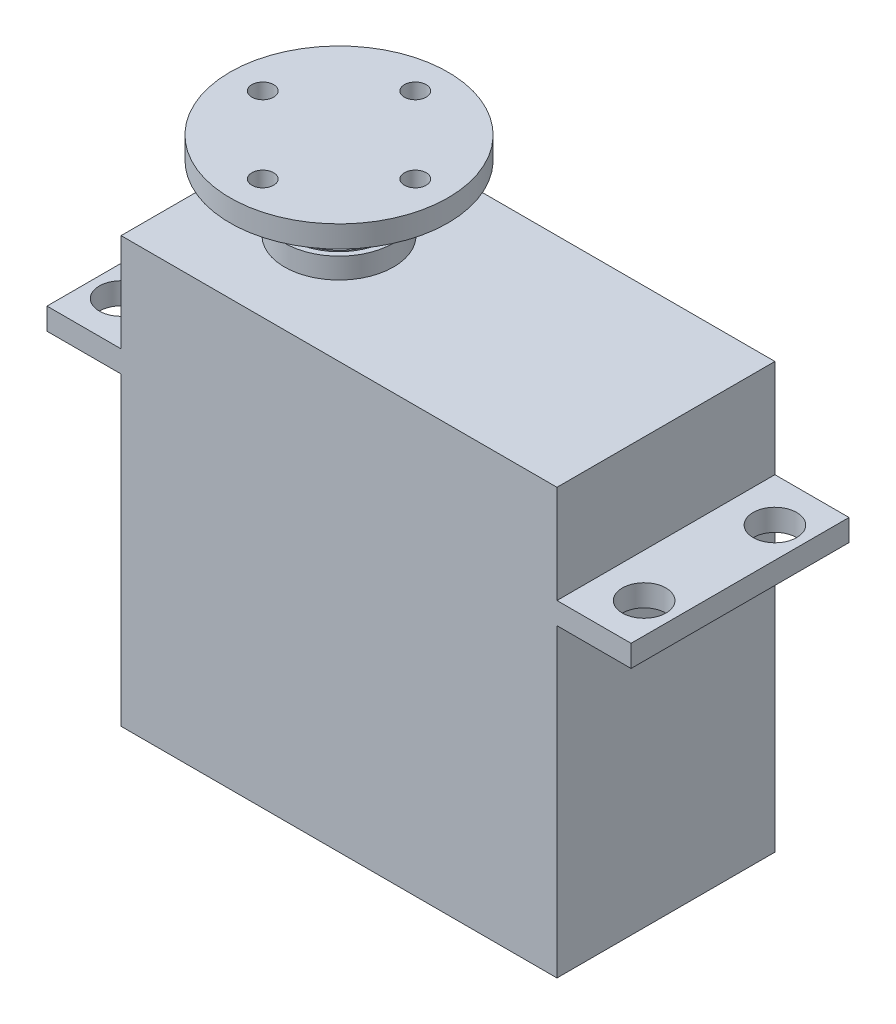
from build123d import *

# Parameters (mm, degrees)
SKETCH1_W           = 6.8
SKETCH1_H           = 2
SKETCH1_W_2         = 40
SKETCH1_H_2         = 39
BOSS_EXTRUDE1_DEPTH = 20
SKETCH2_R           = 4.5
BOSS_EXTRUDE2_DEPTH = 2
SKETCH3_R           = 5
BOSS_EXTRUDE3_DEPTH = 1.9
SKETCH4_R           = 3
BOSS_EXTRUDE4_DEPTH = 4
SKETCH5_R           = 10
BOSS_EXTRUDE5_DEPTH = 2
SKETCH6_R           = 2
CUT_EXTRUDE1_DEPTH  = 10
SKETCH7_R           = 2
CUT_EXTRUDE2_DEPTH  = 10
CUT_EXTRUDE3_DEPTH  = 5


with BuildPart() as part:
    # Sketch1 → Boss-Extrude1 (new body)
    with BuildSketch(Plane.XY):
        with Locations((-23.4, 7.722986842)):
            Rectangle(SKETCH1_W, SKETCH1_H)
        with Locations((0, -1.777013158)):
            Rectangle(SKETCH1_W_2, SKETCH1_H_2)
        with Locations((23.4, 7.722986842)):
            Rectangle(SKETCH1_W, SKETCH1_H)
    extrude(amount=BOSS_EXTRUDE1_DEPTH)

    # Sketch2 → Boss-Extrude2 (add)
    with BuildSketch(Plane(origin=(0, 17.722986842, 0), x_dir=(1, 0, 0), z_dir=(0, 1, 0))):
        with Locations(Location((-10, -10, 0), (0, 0, 180))):
            Circle(SKETCH2_R)
    extrude(amount=BOSS_EXTRUDE2_DEPTH)

    # Sketch3 → Boss-Extrude3 (add)
    with BuildSketch(Plane(origin=(0, 17.722986842, 0), x_dir=(1, 0, 0), z_dir=(0, 1, 0))):
        with Locations((-10, -10)):
            Circle(SKETCH3_R)
    extrude(amount=BOSS_EXTRUDE3_DEPTH)

    # Sketch4 → Boss-Extrude4 (add)
    with BuildSketch(Plane(origin=(0, 19.722986842, 0), x_dir=(1, 0, 0), z_dir=(0, 1, 0))):
        with Locations(Location((-10, -10, 0), (0, 0, 180))):
            Circle(SKETCH4_R)
    extrude(amount=BOSS_EXTRUDE4_DEPTH)

    # Sketch5 → Boss-Extrude5 (add)
    with BuildSketch(Plane(origin=(0, 23.722986842, 0), x_dir=(1, 0, 0), z_dir=(0, 1, 0))):
        with Locations(Location((-10, -10, 0), (0, 0, 180))):
            Circle(SKETCH5_R)
    extrude(amount=BOSS_EXTRUDE5_DEPTH)

    # Sketch6 → Cut-Extrude1 (cut)
    with BuildSketch(Plane(origin=(0, 8.722986842, 0), x_dir=(1, 0, 0), z_dir=(0, 1, 0))):
        with Locations(Location((24, -4, 0), (0, 0, 180))):
            Circle(SKETCH6_R)
        with Locations(Location((24, -16, 0), (0, 0, 180))):
            Circle(SKETCH6_R)
    extrude(amount=-CUT_EXTRUDE1_DEPTH, mode=Mode.SUBTRACT)

    # Sketch7 → Cut-Extrude2 (cut)
    with BuildSketch(Plane(origin=(0, 8.722986842, 0), x_dir=(1, 0, 0), z_dir=(0, 1, 0))):
        with Locations(Location((-24, -4, 0), (0, 0, 180))):
            Circle(SKETCH7_R)
        with Locations(Location((-24, -16, 0), (0, 0, 180))):
            Circle(SKETCH7_R)
    extrude(amount=-CUT_EXTRUDE2_DEPTH, mode=Mode.SUBTRACT)

    # Sketch8 → Cut-Extrude3 (cut)
    with BuildSketch(Plane(origin=(0, 25.722986842, 0), x_dir=(1, 0, 0), z_dir=(0, 1, 0))):
        with BuildLine():
            ThreePointArc((-18, -10), (-17, -11), (-16, -10))
            Line((-16, -10), (-18, -10))
        make_face()
        with BuildLine():
            Line((-18, -10), (-16, -10))
            ThreePointArc((-16, -10), (-17, -9), (-18, -10))
        make_face()
        with BuildLine():
            ThreePointArc((-10, -2), (-11, -3), (-10, -4))
            Line((-10, -4), (-10, -2))
        make_face()
        with BuildLine():
            Line((-10, -2), (-10, -4))
            ThreePointArc((-10, -4), (-9.292893219, -3.707106781), (-9, -3))
            ThreePointArc((-9, -3), (-9.292893219, -2.292893219), (-10, -2))
        make_face()
        with BuildLine():
            ThreePointArc((-2, -10), (-3, -9), (-4, -10))
            Line((-4, -10), (-2, -10))
        make_face()
        with BuildLine():
            Line((-2, -10), (-4, -10))
            ThreePointArc((-4, -10), (-3, -11), (-2, -10))
        make_face()
        with BuildLine():
            ThreePointArc((-9, -17), (-9.292893219, -16.292893219), (-10, -16))
            Line((-10, -16), (-10, -18))
            ThreePointArc((-10, -18), (-9.292893219, -17.707106781), (-9, -17))
        make_face()
        with BuildLine():
            Line((-10, -18), (-10, -16))
            ThreePointArc((-10, -16), (-11, -17), (-10, -18))
        make_face()
    extrude(amount=-CUT_EXTRUDE3_DEPTH, mode=Mode.SUBTRACT)


solid = part.part
